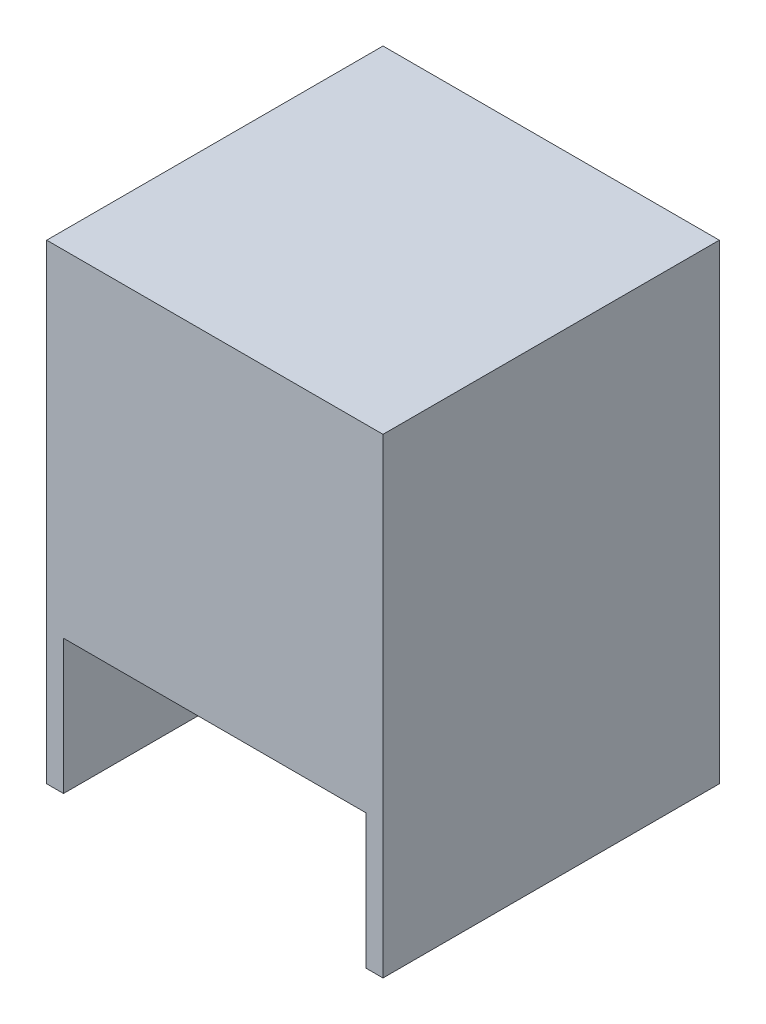
from build123d import *

# Parameters (mm, degrees)
SKETCH1_W           = 1000
SKETCH1_H           = 1000
BOSS_EXTRUDE1_DEPTH = 1000
SKETCH2_W           = 50
SKETCH2_H           = 1000
BOSS_EXTRUDE2_DEPTH = 400


with BuildPart() as part:
    # Sketch1 → Boss-Extrude1 (new body)
    with BuildSketch(Plane(origin=(0, 0, 0), x_dir=(1, 0, 0), z_dir=(0, 1, 0))):
        Rectangle(SKETCH1_W, SKETCH1_H)
    extrude(amount=BOSS_EXTRUDE1_DEPTH)

    # Sketch2 → Boss-Extrude2 (add)
    with BuildSketch(Plane.XZ):
        with Locations((-475, 0)):
            Rectangle(SKETCH2_W, SKETCH2_H)
        with Locations((475, 0)):
            Rectangle(SKETCH2_W, SKETCH2_H)
    extrude(amount=BOSS_EXTRUDE2_DEPTH)


solid = part.part
